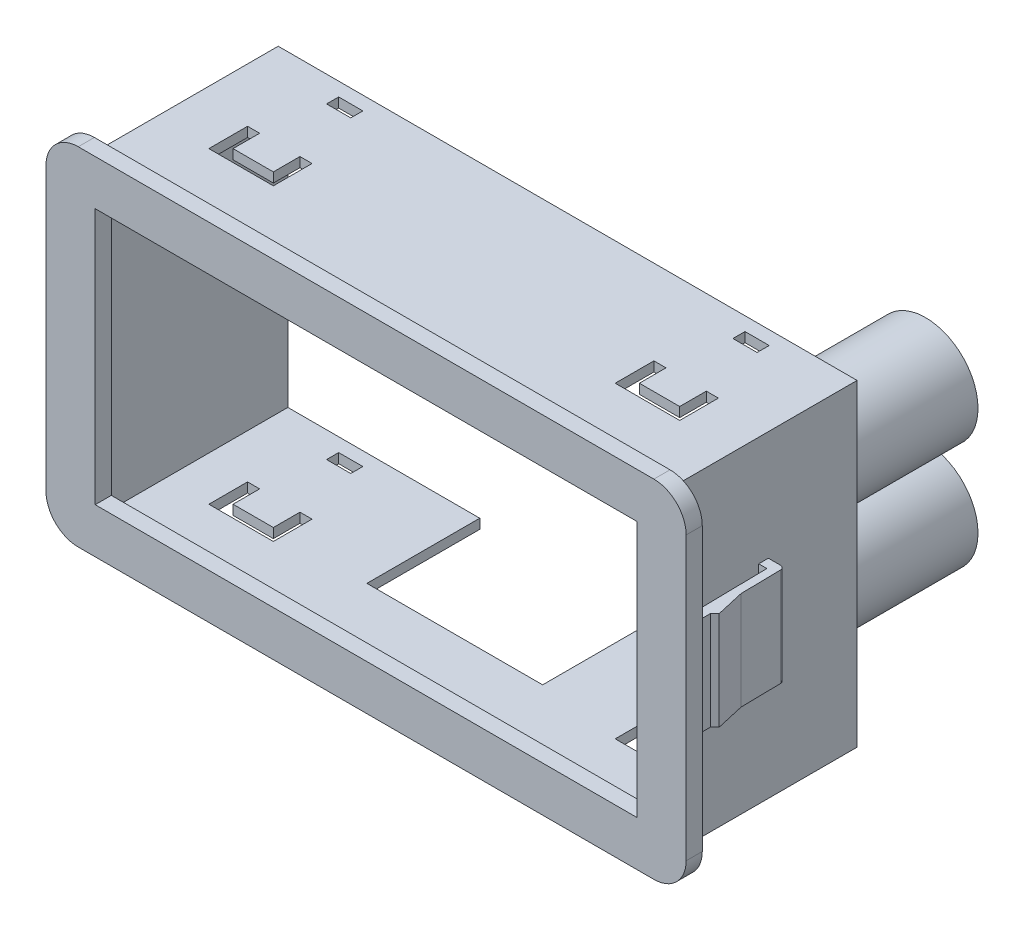
from build123d import *

# Parameters (mm, degrees)
SKETCH_1_W               = 71.8
SKETCH_1_H               = 39.4
SKETCH_1_W_2             = 69.4
SKETCH_1_H_2             = 37
EXTRUDE_1_DEPTH          = 23
SKETCH_2_W               = 67.2
SKETCH_2_H               = 31.8
EXTRUDE_2_DEPTH          = 2
EXTRUDE_3_DEPTH          = 6.1
CUT_EXTRUDE_1_REACH      = 64.438
SKETCH_4_W               = 21.8
SKETCH_4_H               = 14
CUT_EXTRUDE_2_REACH      = 64.438
SKETCH_5_W               = 3
SKETCH_5_H               = 1.5
MIRROR_3_COPY_1_REACH    = 64.438
MIRROR_3_COPY_1_SKETCH_W = 3
MIRROR_3_COPY_1_SKETCH_H = 1.5
SKETCH_6_R               = 6.5
EXTRUDE_4_DEPTH          = 26
EXTRUDE_4_2_DEPTH        = 26


with BuildPart() as part:
    # Эскиз1 → Бобышка-Вытянуть1 (new body)
    with BuildSketch(Plane.XY):
        Rectangle(SKETCH_1_W, SKETCH_1_H)
        Rectangle(SKETCH_1_W_2, SKETCH_1_H_2, mode=Mode.SUBTRACT)
    extrude(amount=EXTRUDE_1_DEPTH)

    # Эскиз2 → Бобышка-Вытянуть2 (add)
    with BuildSketch(Plane.XY.offset(23)):
        with BuildLine():
            Line((-35.7, 21.5), (35.7, 21.5))
            ThreePointArc((35.7, 21.5), (38.528427125, 20.328427125), (39.7, 17.5))
            Line((39.7, 17.5), (39.7, -17.5))
            ThreePointArc((39.7, -17.5), (38.528427125, -20.328427125), (35.7, -21.5))
            Line((35.7, -21.5), (-35.7, -21.5))
            ThreePointArc((-35.7, -21.5), (-38.528427125, -20.328427125), (-39.7, -17.5))
            Line((-39.7, -17.5), (-39.7, 17.5))
            ThreePointArc((-39.7, 17.5), (-38.528427125, 20.328427125), (-35.7, 21.5))
        make_face()
        Rectangle(SKETCH_2_W, SKETCH_2_H, mode=Mode.SUBTRACT)
    extrude(amount=EXTRUDE_2_DEPTH)

    # Эскиз3 → Бобышка-Вытянуть3 (add, symmetric)
    with BuildSketch(Plane(origin=(0, 0, 0), x_dir=(1, 0, 0), z_dir=(0, 1, 0))):
        with BuildLine():
            Line((35.9, -12.2), (36.910909091, -12.2))
            Line((36.910909091, -12.2), (37.1, -22.6))
            Line((37.1, -22.6), (38.25, -22.6))
            Line((38.25, -22.6), (38.25, -20.510644536))
            Line((38.25, -20.510644536), (38.8, -20))
            Line((38.8, -20), (38, -16.5))
            Line((38, -16.5), (37.908925647, -11.490910593))
            ThreePointArc((37.908925647, -11.490910593), (37.759333332, -11.143247492), (37.409008271, -11))
            Line((37.409008271, -11), (35.9, -11))
            Line((35.9, -11), (35.9, -12.2))
        make_face()
    extrude_3 = extrude(amount=EXTRUDE_3_DEPTH, both=True)

    # Зеркальное отражение1: Бобышка-Вытянуть3 across plane
    add(extrude_3.mirror(Plane(origin=(0, 0, 0), x_dir=(0, 0, 1), z_dir=(1, 0, 0))))

    # Эскиз4 → Вырез-Вытянуть1 (cut, up to next)
    with BuildSketch(Plane.XZ.offset(19.7), mode=Mode.PRIVATE) as cut_extrude_1_sk1:
        with Locations((0, 7)):
            Rectangle(SKETCH_4_W, SKETCH_4_H)
    cut_extrude_1_tool1 = extrude(cut_extrude_1_sk1.sketch, amount=-CUT_EXTRUDE_1_REACH, mode=Mode.PRIVATE) & part.part
    add(cut_extrude_1_tool1.solids().sort_by_distance((0, -19.7, 7))[0], mode=Mode.SUBTRACT)

    # Эскиз5 → Вырез-Вытянуть2 (cut, up to next)
    with BuildSketch(Plane(origin=(0, 19.7, 0), x_dir=(1, 0, 0), z_dir=(0, 1, 0)), mode=Mode.PRIVATE) as cut_extrude_2_sk1:
        Polygon((-29.2, -10.5), (-29.2, -15.3), (-21.2, -15.3), (-21.2, -10.5), (-22.7, -10.5), (-22.7, -13.8), (-27.7, -13.8), (-27.7, -10.5), align=None)
    cut_extrude_2_tool1 = extrude(cut_extrude_2_sk1.sketch, amount=-CUT_EXTRUDE_2_REACH, mode=Mode.PRIVATE) & part.part
    # Эскиз5 → Вырез-Вытянуть2 (cut, up to next)
    with BuildSketch(Plane(origin=(0, 19.7, 0), x_dir=(1, 0, 0), z_dir=(0, 1, 0)), mode=Mode.PRIVATE) as cut_extrude_2_sk2:
        with Locations((-25.2, -2.45)):
            Rectangle(SKETCH_5_W, SKETCH_5_H)
    cut_extrude_2_tool2 = extrude(cut_extrude_2_sk2.sketch, amount=-CUT_EXTRUDE_2_REACH, mode=Mode.PRIVATE) & part.part
    cut_extrude_2_1 = cut_extrude_2_tool1.solids().sort_by_distance((-29.106705, 19.7, 12.9))[0]
    add(cut_extrude_2_1, mode=Mode.SUBTRACT)
    cut_extrude_2_2 = cut_extrude_2_tool2.solids().sort_by_distance((-25.2, 19.7, 2.45))[0]
    add(cut_extrude_2_2, mode=Mode.SUBTRACT)
    cut_extrude_2 = cut_extrude_2_1 + cut_extrude_2_2  # Вырез-Вытянуть2 as one shape, for the pattern or mirror that repeats it

    # Зеркальное отражение2: Вырез-Вытянуть2 across plane
    add(cut_extrude_2.mirror(Plane(origin=(0, 0, 0), x_dir=(0, 0, 1), z_dir=(1, 0, 0))), mode=Mode.SUBTRACT)

    # Зеркальное отражение3: Вырез-Вытянуть2 across plane
    add(cut_extrude_2.mirror(Plane.ZX), mode=Mode.SUBTRACT)

    # Зеркальное отражение3 copy 1 sketch → Зеркальное отражение3 copy 1 (cut, up to next)
    with BuildSketch(Plane(origin=(0, -19.7, 0), x_dir=(-1, 0, 0), z_dir=(0, -1, 0)), mode=Mode.PRIVATE) as mirror_3_copy_1_sk1:
        Polygon((-29.2, -10.5), (-29.2, -15.3), (-21.2, -15.3), (-21.2, -10.5), (-22.7, -10.5), (-22.7, -13.8), (-27.7, -13.8), (-27.7, -10.5), align=None)
    mirror_3_copy_1_tool1 = extrude(mirror_3_copy_1_sk1.sketch, amount=-MIRROR_3_COPY_1_REACH, mode=Mode.PRIVATE) & part.part
    # Зеркальное отражение3 copy 1 sketch → Зеркальное отражение3 copy 1 (cut, up to next)
    with BuildSketch(Plane(origin=(0, -19.7, 0), x_dir=(-1, 0, 0), z_dir=(0, -1, 0)), mode=Mode.PRIVATE) as mirror_3_copy_1_sk2:
        with Locations((-25.2, -2.45)):
            Rectangle(MIRROR_3_COPY_1_SKETCH_W, MIRROR_3_COPY_1_SKETCH_H)
    mirror_3_copy_1_tool2 = extrude(mirror_3_copy_1_sk2.sketch, amount=-MIRROR_3_COPY_1_REACH, mode=Mode.PRIVATE) & part.part
    add(mirror_3_copy_1_tool1.solids().sort_by_distance((29.106705, -19.7, 12.9))[0], mode=Mode.SUBTRACT)
    add(mirror_3_copy_1_tool2.solids().sort_by_distance((25.2, -19.7, 2.45))[0], mode=Mode.SUBTRACT)


with BuildPart() as body_2:
    # Эскиз6 → Бобышка-Вытянуть4 (new body)
    with BuildSketch(Plane(origin=(0, 0, 9), x_dir=(-1, 0, 0), z_dir=(0, 0, -1))):
        with Locations(Location((-27.4, 7.2, 0), (0, 0, 180))):
            Circle(SKETCH_6_R)
    extrude(amount=EXTRUDE_4_DEPTH)


with BuildPart() as body_3:
    # Эскиз6 → Extrude 4 2 (new body)
    with BuildSketch(Plane(origin=(0, 0, 9), x_dir=(-1, 0, 0), z_dir=(0, 0, -1))):
        with Locations(Location((-27.4, -6.2, 0), (0, 0, 180))):
            Circle(SKETCH_6_R)
    extrude(amount=EXTRUDE_4_2_DEPTH)


solid = Compound([part.part, body_2.part, body_3.part])
